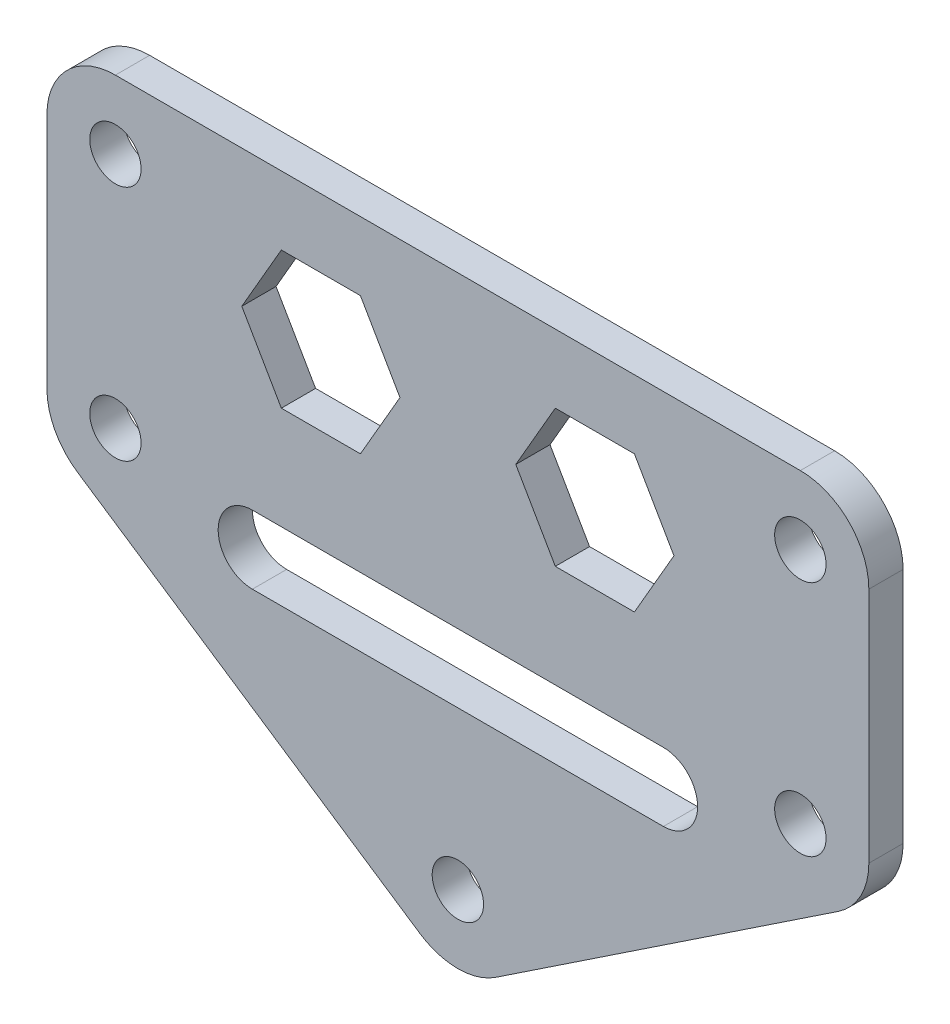
from build123d import *

# Parameters (mm, degrees)
SKETCH1_R           = 4.7625
BOSS_EXTRUDE1_DEPTH = 6.35


with BuildPart() as part:
    # Sketch1 → Boss-Extrude1 (new body)
    with BuildSketch(Plane.XY):
        with BuildLine():
            Line((7.044692492, 4.696461661), (70.544692492, 47.029794995))
            ThreePointArc((70.544692492, 47.029794995), (74.697267404, 51.604238079), (76.2, 57.596833733))
            Line((76.2, 57.596833733), (76.2, 101.6))
            ThreePointArc((76.2, 101.6), (72.480256121, 110.580256121), (63.5, 114.3))
            Line((63.5, 114.3), (-63.5, 114.3))
            ThreePointArc((-63.5, 114.3), (-72.480256121, 110.580256121), (-76.2, 101.6))
            Line((-76.2, 101.6), (-76.2, 57.596833733))
            ThreePointArc((-76.2, 57.596833733), (-74.697267404, 51.604238079), (-70.544692492, 47.029794995))
            Line((-70.544692492, 47.029794995), (-7.044692492, 4.696461661))
            ThreePointArc((-7.044692492, 4.696461661), (0, 2.563500399), (7.044692492, 4.696461661))
        make_face()
        with Locations((-63.5, 101.6)):
            Circle(SKETCH1_R, mode=Mode.SUBTRACT)
        with Locations((-63.5, 57.596833733)):
            Circle(SKETCH1_R, mode=Mode.SUBTRACT)
        with Locations((63.5, 101.6)):
            Circle(SKETCH1_R, mode=Mode.SUBTRACT)
        with Locations((63.5, 57.596833733)):
            Circle(SKETCH1_R, mode=Mode.SUBTRACT)
        with Locations((0, 15.263500399)):
            Circle(SKETCH1_R, mode=Mode.SUBTRACT)
        with BuildLine():
            Line((-38.1, 57.15), (38.1, 57.15))
            ThreePointArc((38.1, 57.15), (44.45, 50.8), (38.1, 44.45))
            Line((38.1, 44.45), (-38.1, 44.45))
            ThreePointArc((-38.1, 44.45), (-44.45, 50.8), (-38.1, 57.15))
        make_face(mode=Mode.SUBTRACT)
        Polygon((-10.735303163, 88.9), (-18.067651581, 101.6), (-32.732348419, 101.6), (-40.064696837, 88.9), (-32.732348419, 76.2), (-18.067651581, 76.2), align=None, mode=Mode.SUBTRACT)
        Polygon((40.064696837, 88.9), (32.732348419, 101.6), (18.067651581, 101.6), (10.735303163, 88.9), (18.067651581, 76.2), (32.732348419, 76.2), align=None, mode=Mode.SUBTRACT)
    extrude(amount=BOSS_EXTRUDE1_DEPTH)


solid = part.part
